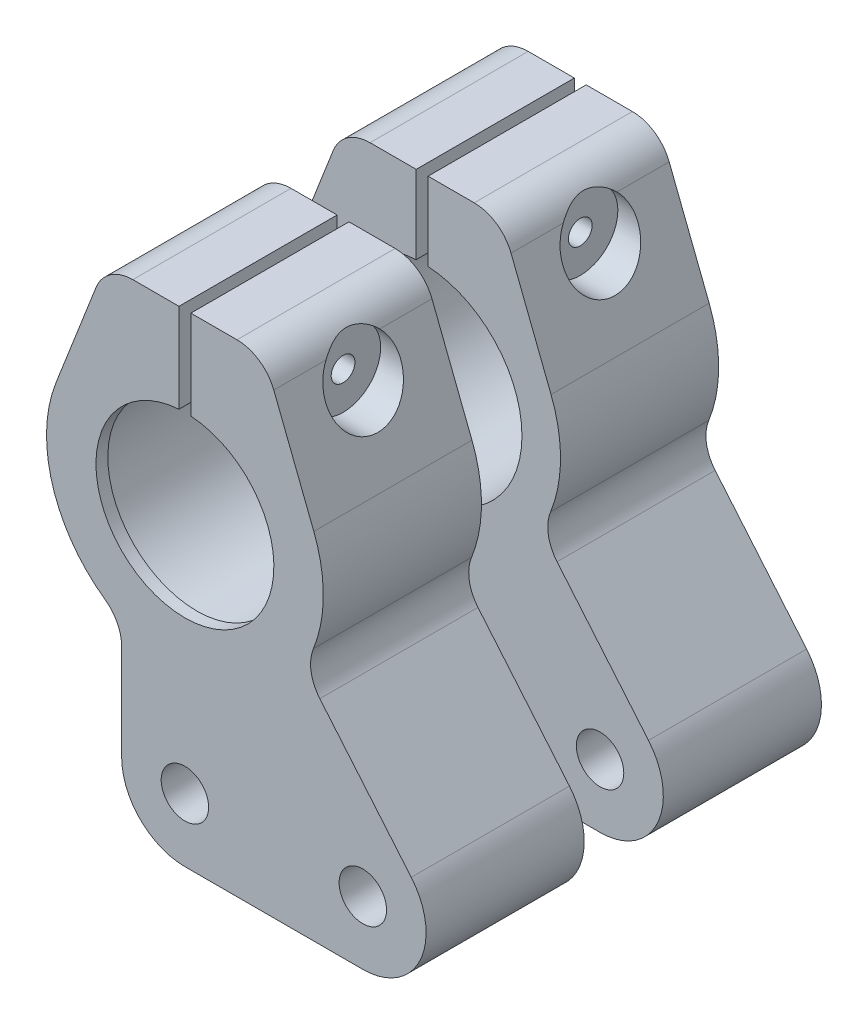
from build123d import *

# Parameters (mm, degrees)
SKETCH1_R           = 6
BOSS_EXTRUDE3_DEPTH = 40
FILLET2_R           = 10
SKETCH5_R           = 9.5
CUT_EXTRUDE1_DEPTH  = 10
SKETCH6_R           = 3
CUT_EXTRUDE2_DEPTH  = 21.5
BOSS_EXTRUDE4_START = -3
BOSS_EXTRUDE4_DEPTH = 3


with BuildPart() as part:
    # Sketch1 → Boss-Extrude3 (new body)
    with BuildSketch(Plane.XY):
        with BuildLine():
            Line((-16, -31.128764833), (-16, -61))
            ThreePointArc((-16, -61), (-11.313708499, -72.313708499), (0, -77))
            Line((0, -77), (45, -77))
            ThreePointArc((45, -77), (59.500924593, -67.761892188), (57.25671109, -50.715398245))
            Line((57.25671109, -50.715398245), (29.928255065, -18.146612597))
            ThreePointArc((29.928255065, -18.146612597), (34.869538701, -3.019150675), (32.601897088, 12.732490183))
            Line((32.601897088, 12.732490183), (20, 45))
            Line((20, 45), (1.5, 45))
            Line((1.5, 45), (1.5, 25.205406166))
            ThreePointArc((1.5, 25.205406166), (0, -25.25), (-1.5, 25.205406166))
            Line((-1.5, 25.205406166), (-1.5, 45))
            Line((-1.5, 45), (-20, 45))
            Line((-20, 45), (-32.601897088, 12.732490183))
            ThreePointArc((-32.601897088, 12.732490183), (-32.733599298, -12.389974858), (-16, -31.128764833))
        make_face()
        with Locations((0, -61)):
            Circle(SKETCH1_R, mode=Mode.SUBTRACT)
        with Locations((45, -61)):
            Circle(SKETCH1_R, mode=Mode.SUBTRACT)
    extrude(amount=BOSS_EXTRUDE3_DEPTH)

    # Fillet2
    fillet2_edges = [part.edges().sort_by_distance(p)[0] for p in [
        (-20, 45, 20),
        (20, 45, 20),
        (29.928255065, -18.146612597, 20),
        (-16, -31.128764833, 20),
    ]]
    fillet(fillet2_edges, radius=FILLET2_R)

    # Sketch5 → Cut-Extrude1 (cut)
    with BuildSketch(Plane(origin=(-20, 0, 0), x_dir=(0, 0, -1), z_dir=(1, 0, 0))):
        with Locations((-20, 32)):
            Circle(SKETCH5_R)
    cut_extrude1 = extrude(amount=-CUT_EXTRUDE1_DEPTH, mode=Mode.SUBTRACT)

    # Sketch6 → Cut-Extrude2 (cut)
    with BuildSketch(Plane.ZY.offset(20)):
        with Locations((20, 32)):
            Circle(SKETCH6_R)
    cut_extrude2 = extrude(amount=-CUT_EXTRUDE2_DEPTH, mode=Mode.SUBTRACT)

    # Mirror3: Cut-Extrude1, Cut-Extrude2 across plane
    add(cut_extrude1.mirror(Plane(origin=(0, 0, 0), x_dir=(0, 0, 1), z_dir=(1, 0, 0))), mode=Mode.SUBTRACT)
    add(cut_extrude2.mirror(Plane(origin=(0, 0, 0), x_dir=(0, 0, 1), z_dir=(1, 0, 0))), mode=Mode.SUBTRACT)

    # Sketch7 → Boss-Extrude4 (add)
    with BuildSketch(Plane.XY.offset(40).offset(BOSS_EXTRUDE4_START)):
        with BuildLine():
            ThreePointArc((22.5, 0), (-15.370426149, -16.431676725), (-1.5, 22.449944321))
            Line((-1.5, 22.449944321), (-1.5, 25.205406166))
            ThreePointArc((-1.5, 25.205406166), (-17.315996939, -18.377125727), (25.25, 0))
            ThreePointArc((25.25, 0), (18.377125727, 17.315996939), (1.5, 25.205406166))
            Line((1.5, 25.205406166), (1.5, 22.449944321))
            ThreePointArc((1.5, 22.449944321), (16.431676725, 15.370426149), (22.5, 0))
        make_face()
    extrude(amount=BOSS_EXTRUDE4_DEPTH)


with BuildPart() as body_2:
    # Mirror6: mirrored copy
    add(part.part.mirror(Plane.XY.offset(-10)))


solid = Compound([part.part, body_2.part])
